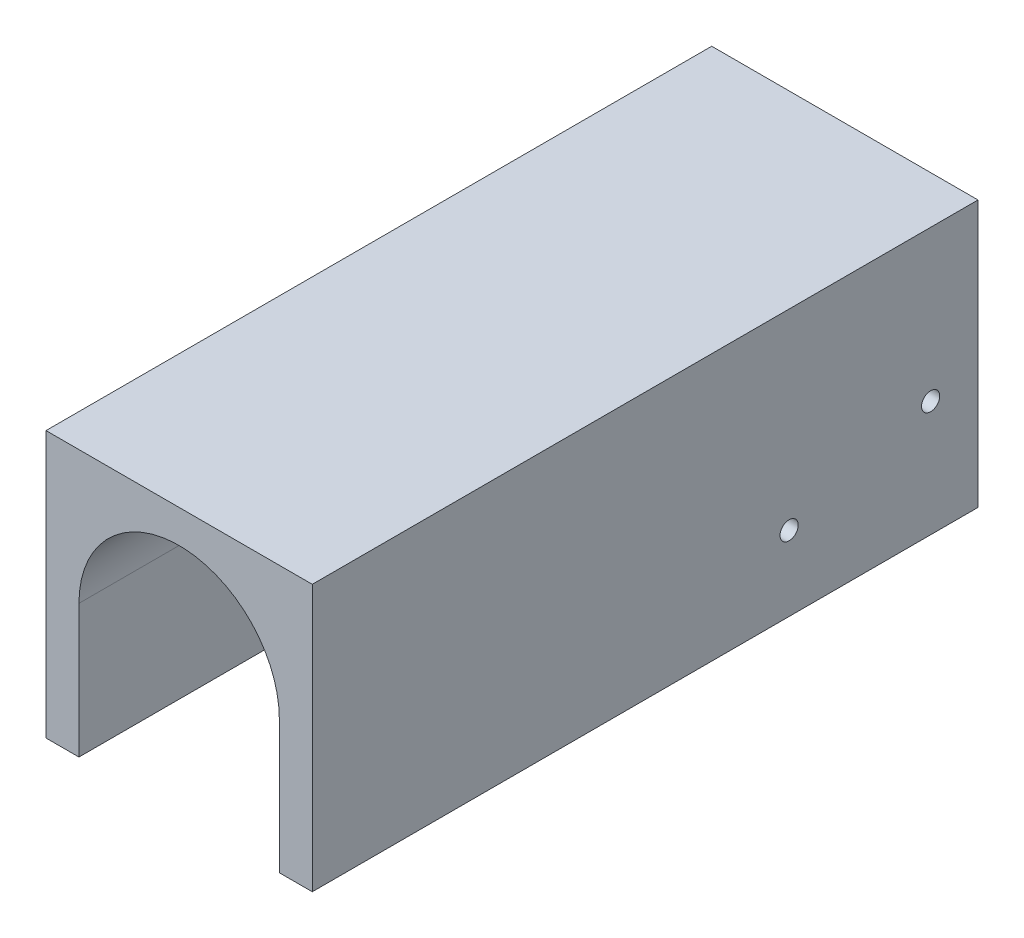
from build123d import *

# Parameters (mm, degrees)
SKETCH_1_W               = 150
SKETCH_1_H               = 60
EXTRUDE_1_DEPTH          = 30
CUT_EXTRUDE_1_DEPTH      = 100
CUT_EXTRUDE_2_DEPTH      = 165.316767252
CUT_EXTRUDE_2_DEPTH_BACK = 165.316767252
SKETCH_5_R               = 2.05


with BuildPart() as part:
    # 스케치1 → 보스-돌출1 (new, symmetric)
    with BuildSketch(Plane(origin=(0, 0, 0), x_dir=(0, 0, -1), z_dir=(1, 0, 0))):
        with Locations((75, -30)):
            Rectangle(SKETCH_1_W, SKETCH_1_H)
    extrude(amount=EXTRUDE_1_DEPTH, both=True)

    # 스케치4 → 컷-돌출1 (cut)
    with BuildSketch(Plane.XY):
        with BuildLine():
            Line((-22.575, -30), (-22.575, -60))
            Line((-22.575, -60), (22.575, -60))
            Line((22.575, -60), (22.575, -30))
            ThreePointArc((22.575, -30), (0, -7.425), (-22.575, -30))
        make_face()
    extrude(amount=-CUT_EXTRUDE_1_DEPTH, mode=Mode.SUBTRACT)

    # 스케치5 → 컷-돌출2 (cut, two sides: drawn at the far end of the back side and taken through both)
    with BuildSketch(Plane(origin=(0, 0, 0), x_dir=(0, 0, -1), z_dir=(1, 0, 0)).offset(-CUT_EXTRUDE_2_DEPTH_BACK)):
        with Locations((107.446436282, -43.174787846)):
            Circle(SKETCH_5_R)
        with Locations((139.331395941, -33.939123257)):
            Circle(SKETCH_5_R)
    extrude(amount=CUT_EXTRUDE_2_DEPTH + CUT_EXTRUDE_2_DEPTH_BACK, mode=Mode.SUBTRACT)


solid = part.part
